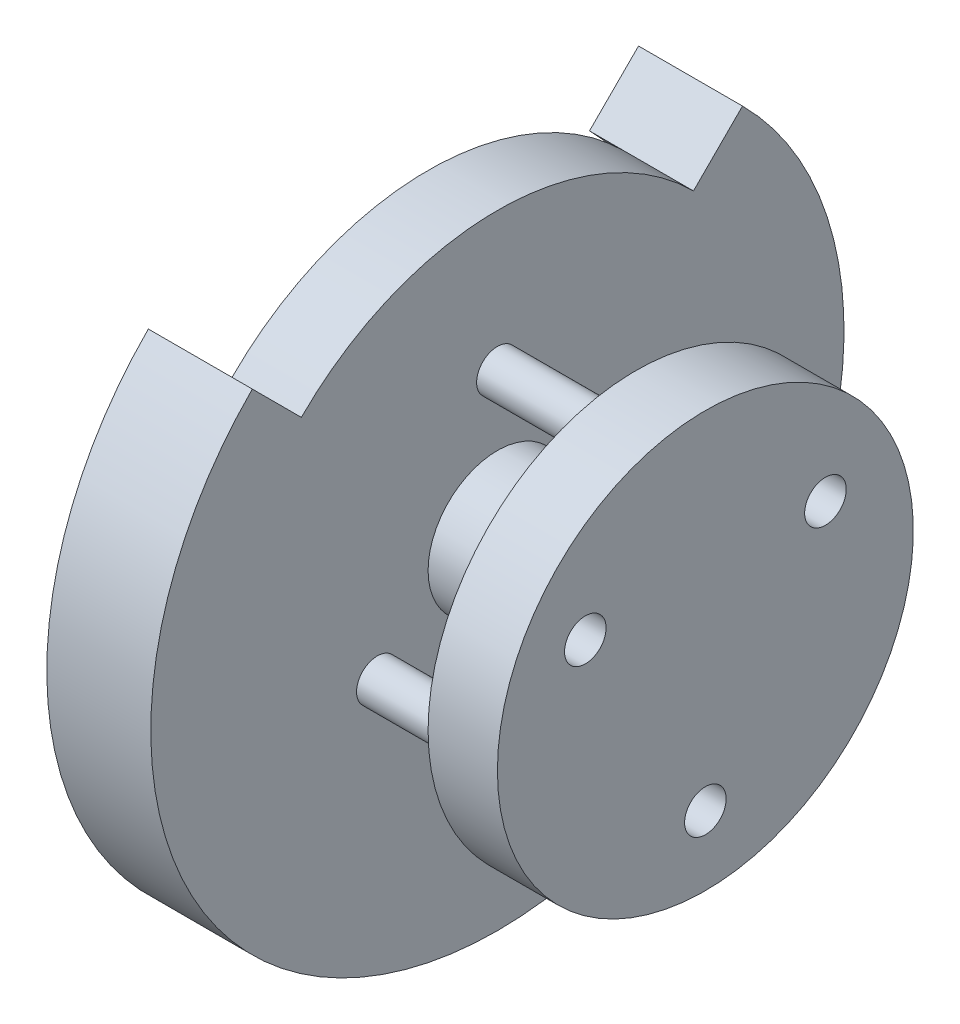
from build123d import *

# Parameters (mm, degrees)
CORTAR_EXTRUIR2_DEPTH   = 7.5
CORTAR_EXTRUIR3_DEPTH   = 2.5
CROQUIS5_R              = 1.5
CORTAR_EXTRUIR4_DEPTH   = 5
CROQUIS6_R              = 1.5
SALIENTE_EXTRUIR1_DEPTH = 15
CORTAR_EXTRUIR5_DEPTH   = 5


with BuildPart() as part:
    # Croquis1 → Revolución1 (revolve)
    with BuildSketch(Plane(origin=(0, 0, 0), x_dir=(1, 0, 0), z_dir=(0, 1, 0)), mode=Mode.PRIVATE) as revoluci_n1_sk:
        Polygon((0, 0), (22.5, 0), (22.5, 15), (17.5, 15), (17.5, 5), (7.5, 5), (7.5, 25), (0, 25), (0, 20), (2.5, 20), (2.5, 10), (0, 10), align=None)
    revolve(revoluci_n1_sk.sketch.rotate(Axis((0, 0, 0), (1, 0, 0)), 180), axis=Axis((0, 0, 0), (1, 0, 0)))

    # Croquis2 → Cortar-Extruir2 (cut)
    with BuildSketch(Plane.ZY):
        with BuildLine():
            ThreePointArc((-14.142135624, 14.142135624), (0, 20), (14.142135624, 14.142135624))
            Line((14.142135624, 14.142135624), (17.67766953, 17.67766953))
            ThreePointArc((17.67766953, 17.67766953), (0, 25), (-17.67766953, 17.67766953))
            Line((-17.67766953, 17.67766953), (-14.142135624, 14.142135624))
        make_face()
    extrude(amount=-CORTAR_EXTRUIR2_DEPTH, mode=Mode.SUBTRACT)

    # Croquis4 → Cortar-Extruir3 (cut)
    with BuildSketch(Plane.ZY):
        with BuildLine():
            ThreePointArc((1.743114855, -19.923893962), (0, -20), (-1.743114855, -19.923893962))
            Line((-1.743114855, -19.923893962), (-2.178893569, -24.904867452))
            ThreePointArc((-2.178893569, -24.904867452), (0, -25), (2.178893569, -24.904867452))
            Line((2.178893569, -24.904867452), (1.743114855, -19.923893962))
        make_face()
    extrude(amount=-CORTAR_EXTRUIR3_DEPTH, mode=Mode.SUBTRACT)

    # Croquis5 → Cortar-Extruir4 (cut)
    with BuildSketch(Plane(origin=(22.5, 0, 0), x_dir=(0, 0, -1), z_dir=(1, 0, 0))):
        with Locations((0, -10)):
            Circle(CROQUIS5_R)
        with Locations((-8.660254038, 5)):
            Circle(CROQUIS5_R)
        with Locations((8.660254038, 5)):
            Circle(CROQUIS5_R)
    extrude(amount=-CORTAR_EXTRUIR4_DEPTH, mode=Mode.SUBTRACT)

    # Croquis6 → Saliente-Extruir1 (add)
    with BuildSketch(Plane(origin=(22.5, 0, 0), x_dir=(0, 0, -1), z_dir=(1, 0, 0))):
        with Locations((0, 10)):
            Circle(CROQUIS6_R)
        with Locations((8.660254038, -5)):
            Circle(CROQUIS6_R)
        with Locations((-8.660254038, -5)):
            Circle(CROQUIS6_R)
    extrude(amount=-SALIENTE_EXTRUIR1_DEPTH)

    # Croquis7 → Cortar-Extruir5 (cut)
    with BuildSketch(Plane.ZY):
        with BuildLine():
            Line((-0.23528257, 1.885375854), (-0.796607872, 3.057943083))
            ThreePointArc((-0.796607872, 3.057943083), (-0.979134174, 3.319175723), (-1.21, 3.538855747))
            ThreePointArc((-1.21, 3.538855747), (-1.431236037, 3.455309452), (-1.646749691, 3.357948102))
            ThreePointArc((-1.646749691, 3.357948102), (-1.654659248, 3.039364075), (-1.599005463, 2.725579118))
            Line((-1.599005463, 2.725579118), (-1.166792151, 1.499531952))
            ThreePointArc((-1.166792151, 1.499531952), (-1.343502884, 1.343502884), (-1.499531952, 1.166792151))
            Line((-1.499531952, 1.166792151), (-2.725579118, 1.599005463))
            ThreePointArc((-2.725579118, 1.599005463), (-3.039364075, 1.654659248), (-3.357948102, 1.646749691))
            ThreePointArc((-3.357948102, 1.646749691), (-3.455309452, 1.431236037), (-3.538855747, 1.21))
            ThreePointArc((-3.538855747, 1.21), (-3.319175723, 0.979134174), (-3.057943083, 0.796607872))
            Line((-3.057943083, 0.796607872), (-1.885375854, 0.23528257))
            ThreePointArc((-1.885375854, 0.23528257), (-1.9, 0), (-1.885375854, -0.23528257))
            Line((-1.885375854, -0.23528257), (-3.057943083, -0.796607872))
            ThreePointArc((-3.057943083, -0.796607872), (-3.319175723, -0.979134174), (-3.538855747, -1.21))
            ThreePointArc((-3.538855747, -1.21), (-3.455309452, -1.431236037), (-3.357948102, -1.646749691))
            ThreePointArc((-3.357948102, -1.646749691), (-3.039364075, -1.654659248), (-2.725579118, -1.599005463))
            Line((-2.725579118, -1.599005463), (-1.499531952, -1.166792151))
            ThreePointArc((-1.499531952, -1.166792151), (-1.343502884, -1.343502884), (-1.166792151, -1.499531952))
            Line((-1.166792151, -1.499531952), (-1.599005463, -2.725579118))
            ThreePointArc((-1.599005463, -2.725579118), (-1.654659248, -3.039364075), (-1.646749691, -3.357948102))
            ThreePointArc((-1.646749691, -3.357948102), (-1.431236037, -3.455309452), (-1.21, -3.538855747))
            ThreePointArc((-1.21, -3.538855747), (-0.979134174, -3.319175723), (-0.796607872, -3.057943083))
            Line((-0.796607872, -3.057943083), (-0.23528257, -1.885375854))
            ThreePointArc((-0.23528257, -1.885375854), (0, -1.9), (0.23528257, -1.885375854))
            Line((0.23528257, -1.885375854), (0.796607872, -3.057943083))
            ThreePointArc((0.796607872, -3.057943083), (0.979134174, -3.319175723), (1.21, -3.538855747))
            ThreePointArc((1.21, -3.538855747), (1.431236037, -3.455309452), (1.646749691, -3.357948102))
            ThreePointArc((1.646749691, -3.357948102), (1.654659248, -3.039364075), (1.599005463, -2.725579118))
            Line((1.599005463, -2.725579118), (1.166792151, -1.499531952))
            ThreePointArc((1.166792151, -1.499531952), (1.343502884, -1.343502884), (1.499531952, -1.166792151))
            Line((1.499531952, -1.166792151), (2.725579118, -1.599005463))
            ThreePointArc((2.725579118, -1.599005463), (3.039364075, -1.654659248), (3.357948102, -1.646749691))
            ThreePointArc((3.357948102, -1.646749691), (3.455309452, -1.431236037), (3.538855747, -1.21))
            ThreePointArc((3.538855747, -1.21), (3.319175723, -0.979134174), (3.057943083, -0.796607872))
            Line((3.057943083, -0.796607872), (1.885375854, -0.23528257))
            ThreePointArc((1.885375854, -0.23528257), (1.9, 0), (1.885375854, 0.23528257))
            Line((1.885375854, 0.23528257), (3.057943083, 0.796607872))
            ThreePointArc((3.057943083, 0.796607872), (3.319175723, 0.979134174), (3.538855747, 1.21))
            ThreePointArc((3.538855747, 1.21), (3.455309452, 1.431236037), (3.357948102, 1.646749691))
            ThreePointArc((3.357948102, 1.646749691), (3.039364075, 1.654659248), (2.725579118, 1.599005463))
            Line((2.725579118, 1.599005463), (1.499531952, 1.166792151))
            ThreePointArc((1.499531952, 1.166792151), (1.343502884, 1.343502884), (1.166792151, 1.499531952))
            Line((1.166792151, 1.499531952), (1.599005463, 2.725579118))
            ThreePointArc((1.599005463, 2.725579118), (1.654659248, 3.039364075), (1.646749691, 3.357948102))
            ThreePointArc((1.646749691, 3.357948102), (1.431236037, 3.455309452), (1.21, 3.538855747))
            ThreePointArc((1.21, 3.538855747), (0.979134174, 3.319175723), (0.796607872, 3.057943083))
            Line((0.796607872, 3.057943083), (0.23528257, 1.885375854))
            ThreePointArc((0.23528257, 1.885375854), (0.117868309, 1.896340439), (0, 1.9))
            ThreePointArc((0, 1.9), (-0.117868309, 1.896340439), (-0.23528257, 1.885375854))
        make_face()
    extrude(amount=-CORTAR_EXTRUIR5_DEPTH, mode=Mode.SUBTRACT)


solid = part.part
